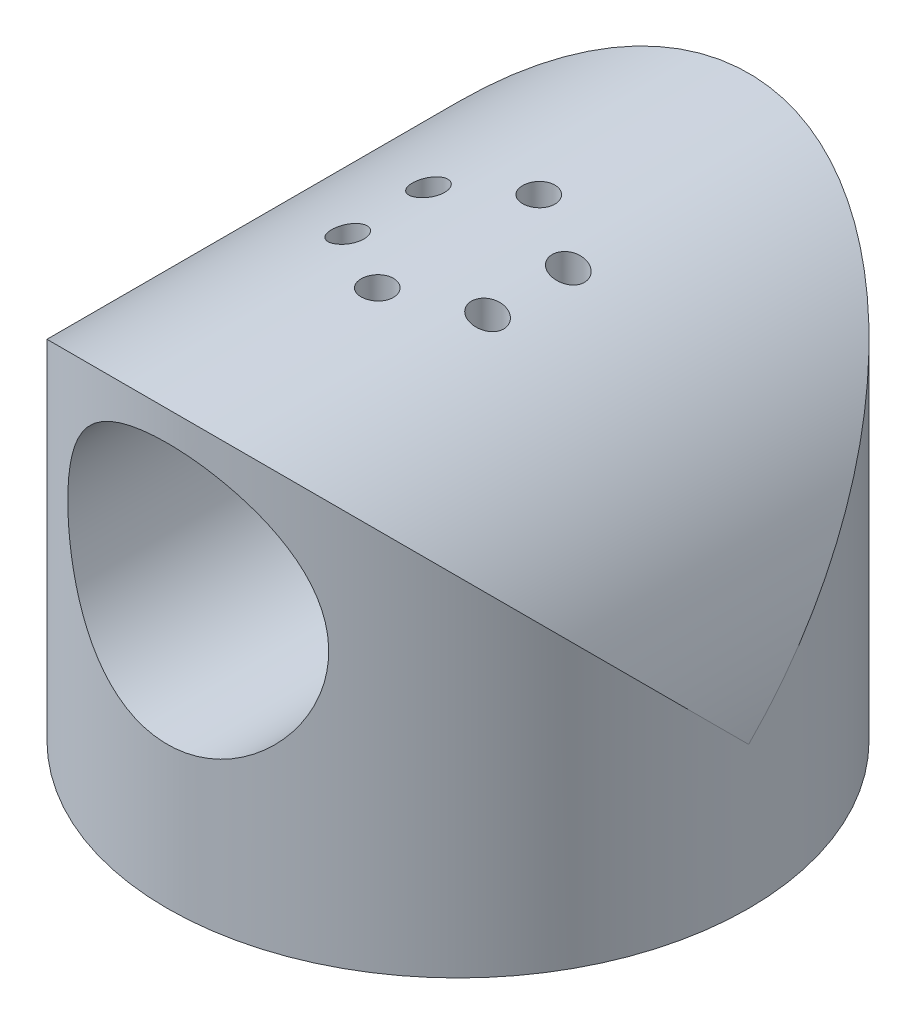
from build123d import *
from build123d.topology import SkipClean

# Parameters (mm, degrees)
SKETCH_1_R           = 45
SKETCH_1_R_2         = 40
EXTRUDE_1_DEPTH      = 17
EXTRUDE_3_DEPTH      = 45
EXTRUDE_3_DEPTH_BACK = 45
SKETCH_4_R           = 20.2
CUT_EXTRUDE_1_DEPTH  = 81.932070281
SKETCH_6_R           = 1.5
CUT_EXTRUDE_3_DEPTH  = 4.8
SKETCH_8_R           = 1.5
CUT_EXTRUDE_4_DEPTH  = 81.932070454
SKETCH_9_R           = 2.5
CUT_EXTRUDE_5_DEPTH  = 80.113842204


with BuildPart() as part:
    # 草图1 → 凸台-拉伸1 (new body)
    with BuildSketch(Plane(origin=(0, 0, 0), x_dir=(1, 0, 0), z_dir=(0, 1, 0))):
        Circle(SKETCH_1_R)
        Circle(SKETCH_1_R_2, mode=Mode.SUBTRACT)
    extrude(amount=EXTRUDE_1_DEPTH)

    # 草图4 → 凸台-拉伸3 (add, two sides: drawn at the far end of the back side and taken through both)
    with BuildSketch(Plane.XY.offset(-EXTRUDE_3_DEPTH_BACK)):
        with BuildLine():
            Line((-45, 22), (-45, 17))
            Line((-45, 17), (45, 17))
            Line((45, 17), (45, 22))
            ThreePointArc((45, 22), (0, 67), (-45, 22))
        make_face()
        with Locations((0, 42.2)):
            Circle(SKETCH_4_R, mode=Mode.SUBTRACT)
    extrude(amount=EXTRUDE_3_DEPTH + EXTRUDE_3_DEPTH_BACK)

    # 草图5 → 切除-拉伸1 (cut, through all)
    with SkipClean():  # the faces are left unmerged after this step: merging them gives an invalid solid
        with BuildSketch(Plane.XZ.offset(-17)):
            with BuildLine():
                Line((-45, 0), (-45, -45))
                Line((-45, -45), (1.13e-07, -45))
                ThreePointArc((1.13e-07, -45), (-31.819805113, -31.819805193), (-45, 0))
            make_face()
            with BuildLine():
                ThreePointArc((45, 0), (31.819805193, -31.819805113), (1.13e-07, -45))
                Line((1.13e-07, -45), (45, -45))
                Line((45, -45), (45, 0))
            make_face()
            with BuildLine():
                Line((-45, 45), (-45, 0))
                ThreePointArc((-45, 0), (-31.819805153, 31.819805153), (0, 45))
                Line((0, 45), (-45, 45))
            make_face()
            with BuildLine():
                ThreePointArc((0, 45), (31.819805153, 31.819805153), (45, 0))
                Line((45, 0), (45, 45))
                Line((45, 45), (0, 45))
            make_face()
        extrude(amount=-CUT_EXTRUDE_1_DEPTH, mode=Mode.SUBTRACT)

    # 草图6 → 切除-拉伸3 (cut)
    with SkipClean():  # the faces are left unmerged after this step: merging them gives an invalid solid
        with BuildSketch(Plane.XZ.offset(-17)):
            with Locations((-5.1, 8.833459119)):
                Circle(SKETCH_6_R)
            with Locations((10.2, 0)):
                Circle(SKETCH_6_R)
            with Locations((-5.1, -8.833459119)):
                Circle(SKETCH_6_R)
        extrude(amount=-CUT_EXTRUDE_3_DEPTH, mode=Mode.SUBTRACT)

    # 草图8 → 切除-拉伸4 (cut, through all)
    with SkipClean():  # the faces are left unmerged after this step: merging them gives an invalid solid
        with BuildSketch(Plane.XZ.offset(-17)):
            with Locations((0, 12.5)):
                Circle(SKETCH_8_R)
            with Locations((10.825317547, 6.25)):
                Circle(SKETCH_8_R)
            with Locations((-10.825317547, 6.25)):
                Circle(SKETCH_8_R)
            with Locations((-10.825317547, -6.25)):
                Circle(SKETCH_8_R)
            with Locations((10.825317547, -6.25)):
                Circle(SKETCH_8_R)
            with Locations((0, -12.5)):
                Circle(SKETCH_8_R)
        extrude(amount=-CUT_EXTRUDE_4_DEPTH, mode=Mode.SUBTRACT)

    # 草图9 → 切除-拉伸5 (cut, through all)
    with SkipClean():  # the faces are left unmerged after this step: merging them gives an invalid solid
        with BuildSketch(Plane(origin=(0, 20, 0), x_dir=(-1, 0, 0), z_dir=(0, -1, 0))):
            with Locations((0, 12.5)):
                Circle(SKETCH_9_R)
            with Locations((10.825317547, 6.25)):
                Circle(SKETCH_9_R)
            with Locations((-10.825317547, 6.25)):
                Circle(SKETCH_9_R)
            with Locations((-10.825317547, -6.25)):
                Circle(SKETCH_9_R)
            with Locations((10.825317547, -6.25)):
                Circle(SKETCH_9_R)
            with Locations((0, -12.5)):
                Circle(SKETCH_9_R)
        extrude(amount=-CUT_EXTRUDE_5_DEPTH, mode=Mode.SUBTRACT)


solid = part.part
